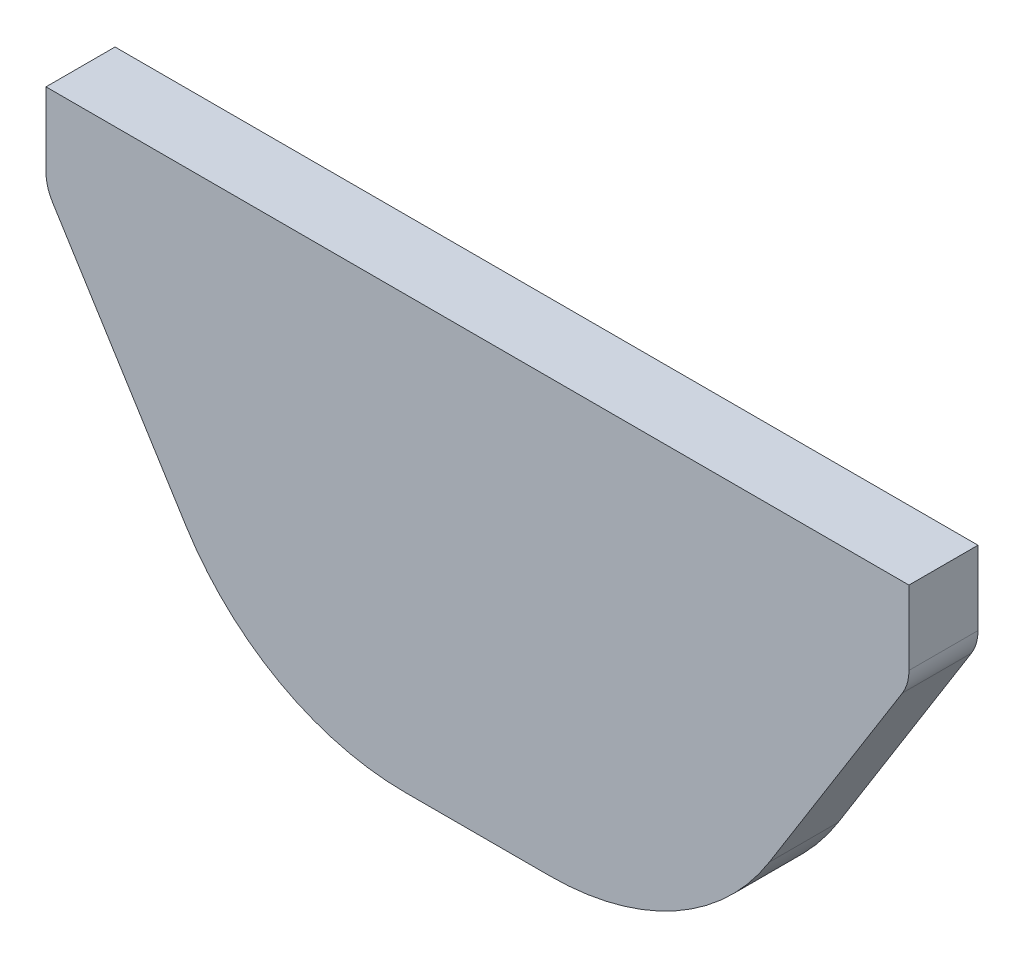
from build123d import *

# Parameters (mm, degrees)
EXTRUDE_1_DEPTH = 8
FILLET_1_R      = 30
FILLET_2_R      = 5


with BuildPart() as part:
    # 草图1 → 凸台-拉伸1 (new body)
    with BuildSketch(Plane.XY):
        Polygon((-25, 0), (25, 0), (50, 40), (50, 50), (-50, 50), (-50, 40), align=None)
    extrude(amount=EXTRUDE_1_DEPTH)

    # 圆角1
    fillet_1_edges = [part.edges().sort_by_distance(p)[0] for p in [
        (25, 0, 4),
        (-25, 0, 4),
    ]]
    fillet(fillet_1_edges, radius=FILLET_1_R)

    # 圆角2
    fillet_2_edges = [part.edges().sort_by_distance(p)[0] for p in [
        (50, 40, 4),
        (-50, 40, 4),
    ]]
    fillet(fillet_2_edges, radius=FILLET_2_R)


solid = part.part
